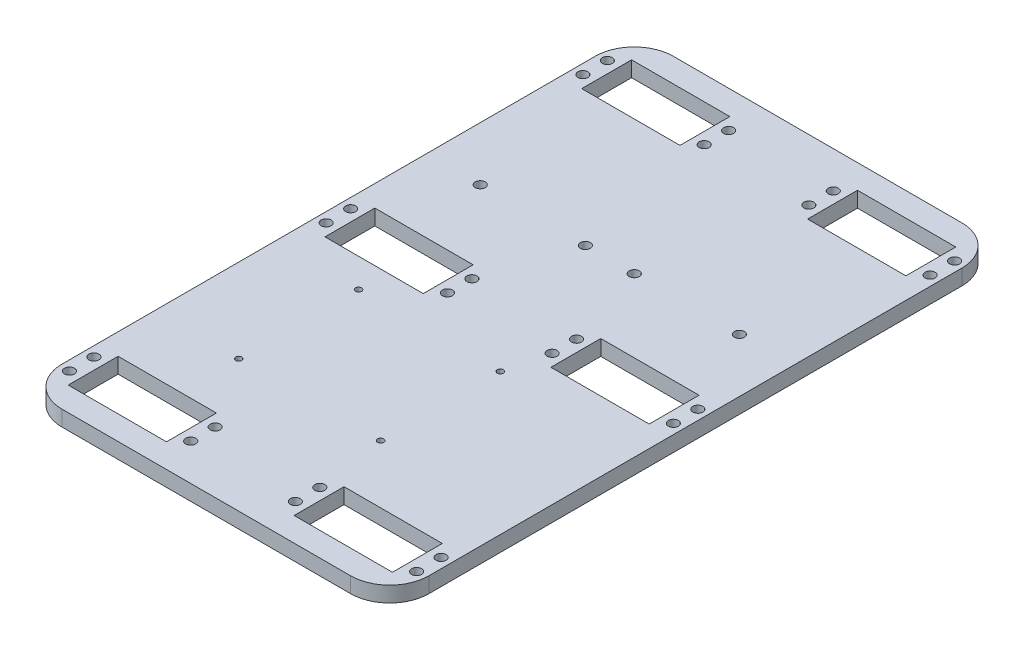
from build123d import *

# Parameters (mm, degrees)
SKETCH1_W           = 150
SKETCH1_H           = 250
SKETCH1_R           = 2.05
SKETCH1_R_2         = 1.25
SKETCH1_W_2         = 40.2
SKETCH1_H_2         = 20.4
BOSS_EXTRUDE1_DEPTH = 6.35
FILLET1_R           = 16


with BuildPart() as part:
    # Sketch1 → Boss-Extrude1 (new body)
    with BuildSketch(Plane(origin=(0, 0, 0), x_dir=(1, 0, 0), z_dir=(0, 1, 0))):
        Rectangle(SKETCH1_W, SKETCH1_H)
        with Locations(Location((-71, 5, 0), (0, 0, 270))):
            Circle(SKETCH1_R, mode=Mode.SUBTRACT)
        with Locations(Location((-71, -5, 0), (0, 0, 270))):
            Circle(SKETCH1_R, mode=Mode.SUBTRACT)
        with Locations(Location((-71, -100, 0), (0, 0, 270))):
            Circle(SKETCH1_R, mode=Mode.SUBTRACT)
        with Locations(Location((-71, -110, 0), (0, 0, 270))):
            Circle(SKETCH1_R, mode=Mode.SUBTRACT)
        with Locations(Location((-71, 110, 0), (0, 0, 90))):
            Circle(SKETCH1_R, mode=Mode.SUBTRACT)
        with Locations(Location((-71, 100, 0), (0, 0, 90))):
            Circle(SKETCH1_R, mode=Mode.SUBTRACT)
        with Locations(Location((-21.4, 100, 0), (0, 0, 270))):
            Circle(SKETCH1_R, mode=Mode.SUBTRACT)
        with Locations(Location((-21.4, 110, 0), (0, 0, 270))):
            Circle(SKETCH1_R, mode=Mode.SUBTRACT)
        with Locations(Location((-21.4, -110, 0), (0, 0, 90))):
            Circle(SKETCH1_R, mode=Mode.SUBTRACT)
        with Locations(Location((-21.4, -100, 0), (0, 0, 90))):
            Circle(SKETCH1_R, mode=Mode.SUBTRACT)
        with Locations(Location((-21.4, -5, 0), (0, 0, 90))):
            Circle(SKETCH1_R, mode=Mode.SUBTRACT)
        with Locations(Location((-21.4, 5, 0), (0, 0, 90))):
            Circle(SKETCH1_R, mode=Mode.SUBTRACT)
        with Locations(Location((21.4, 5, 0), (0, 0, 270))):
            Circle(SKETCH1_R, mode=Mode.SUBTRACT)
        with Locations(Location((21.4, -5, 0), (0, 0, 270))):
            Circle(SKETCH1_R, mode=Mode.SUBTRACT)
        with Locations(Location((21.4, -100, 0), (0, 0, 270))):
            Circle(SKETCH1_R, mode=Mode.SUBTRACT)
        with Locations(Location((21.4, -110, 0), (0, 0, 270))):
            Circle(SKETCH1_R, mode=Mode.SUBTRACT)
        with Locations(Location((21.4, 110, 0), (0, 0, 90))):
            Circle(SKETCH1_R, mode=Mode.SUBTRACT)
        with Locations(Location((21.4, 100, 0), (0, 0, 90))):
            Circle(SKETCH1_R, mode=Mode.SUBTRACT)
        with Locations(Location((71, 100, 0), (0, 0, 270))):
            Circle(SKETCH1_R, mode=Mode.SUBTRACT)
        with Locations(Location((71, 110, 0), (0, 0, 270))):
            Circle(SKETCH1_R, mode=Mode.SUBTRACT)
        with Locations(Location((71, -110, 0), (0, 0, 90))):
            Circle(SKETCH1_R, mode=Mode.SUBTRACT)
        with Locations(Location((71, -100, 0), (0, 0, 90))):
            Circle(SKETCH1_R, mode=Mode.SUBTRACT)
        with Locations(Location((71, -5, 0), (0, 0, 90))):
            Circle(SKETCH1_R, mode=Mode.SUBTRACT)
        with Locations(Location((71, 5, 0), (0, 0, 90))):
            Circle(SKETCH1_R, mode=Mode.SUBTRACT)
        with Locations(Location((-40.75, -22, 0), (0, 0, 270))):
            Circle(SKETCH1_R_2, mode=Mode.SUBTRACT)
        with Locations(Location((-40.75, -71, 0), (0, 0, 270))):
            Circle(SKETCH1_R_2, mode=Mode.SUBTRACT)
        with Locations(Location((17.25, -71, 0), (0, 0, 270))):
            Circle(SKETCH1_R_2, mode=Mode.SUBTRACT)
        with Locations(Location((17.25, -22, 0), (0, 0, 270))):
            Circle(SKETCH1_R_2, mode=Mode.SUBTRACT)
        with Locations(Location((-53, 40, 0), (0, 0, 270))):
            Circle(SKETCH1_R, mode=Mode.SUBTRACT)
        with Locations(Location((-10, 40, 0), (0, 0, 270))):
            Circle(SKETCH1_R, mode=Mode.SUBTRACT)
        with Locations(Location((10, 40, 0), (0, 0, 90))):
            Circle(SKETCH1_R, mode=Mode.SUBTRACT)
        with Locations(Location((53, 40, 0), (0, 0, 90))):
            Circle(SKETCH1_R, mode=Mode.SUBTRACT)
        with Locations((-46.2, -105)):
            Rectangle(SKETCH1_W_2, SKETCH1_H_2, mode=Mode.SUBTRACT)
        with Locations((46.2, -105)):
            Rectangle(SKETCH1_W_2, SKETCH1_H_2, mode=Mode.SUBTRACT)
        with Locations((-46.2, 105)):
            Rectangle(SKETCH1_W_2, SKETCH1_H_2, mode=Mode.SUBTRACT)
        with Locations((46.2, 105)):
            Rectangle(SKETCH1_W_2, SKETCH1_H_2, mode=Mode.SUBTRACT)
        with Locations((-46.2, 0)):
            Rectangle(SKETCH1_W_2, SKETCH1_H_2, mode=Mode.SUBTRACT)
        with Locations((46.2, 0)):
            Rectangle(SKETCH1_W_2, SKETCH1_H_2, mode=Mode.SUBTRACT)
    extrude(amount=BOSS_EXTRUDE1_DEPTH)

    # Fillet1
    fillet1_edges = [part.edges().sort_by_distance(p)[0] for p in [
        (75, 3.175, 125),
        (-75, 3.175, 125),
        (-75, 3.175, -125),
        (75, 3.175, -125),
    ]]
    fillet(fillet1_edges, radius=FILLET1_R)


solid = part.part
